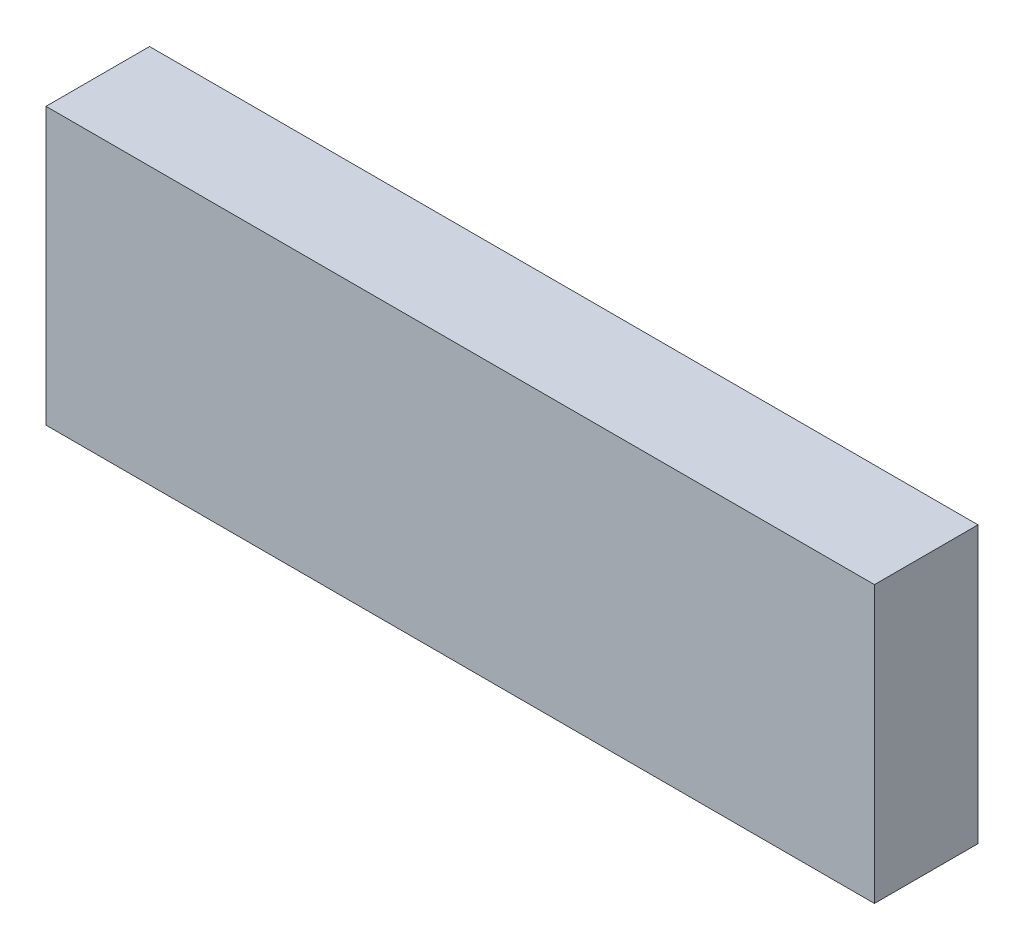
from build123d import *

# Parameters (mm, degrees)
SKETCH1_W           = 1200
SKETCH1_H           = 400
BOSS_EXTRUDE1_DEPTH = 150


with BuildPart() as part:
    # Sketch1 → Boss-Extrude1 (new body)
    with BuildSketch(Plane.XY):
        with Locations((600, 200)):
            Rectangle(SKETCH1_W, SKETCH1_H)
    extrude(amount=BOSS_EXTRUDE1_DEPTH)


solid = part.part
